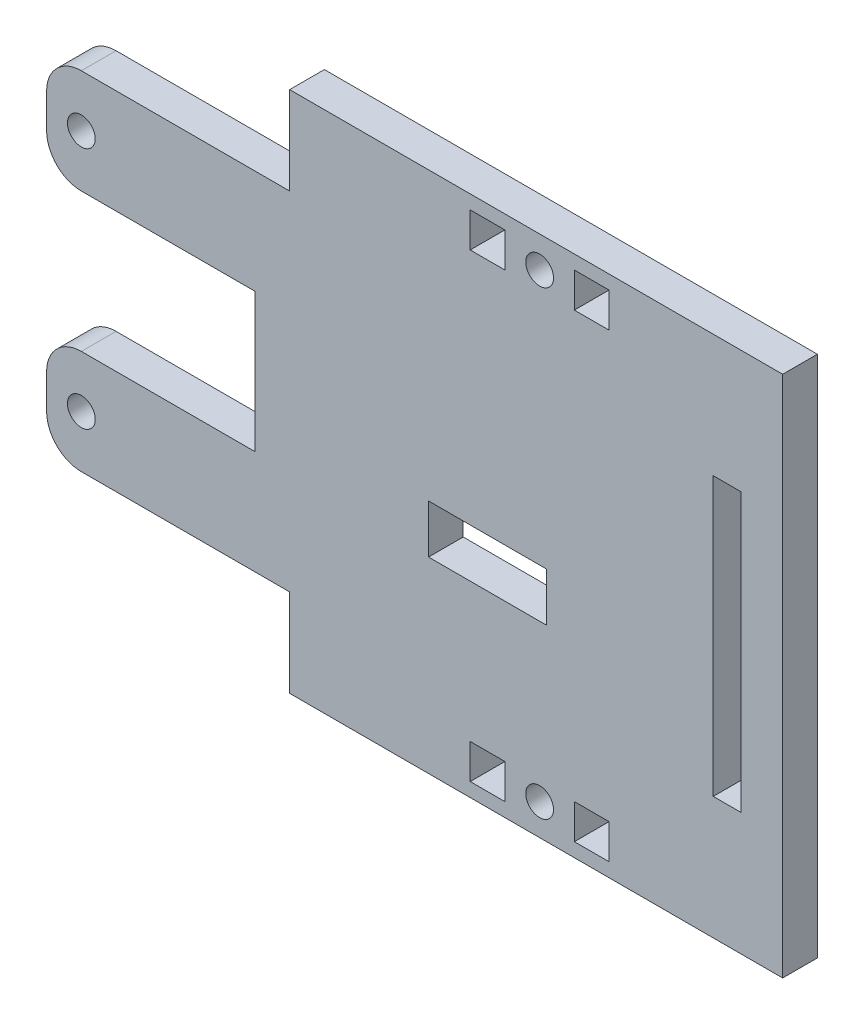
from build123d import *

# Parameters (mm, degrees)
ESQUISSE1_R        = 2
ESQUISSE1_W        = 17
ESQUISSE1_H        = 7
ESQUISSE1_W_2      = 4
ESQUISSE1_H_2      = 40
ESQUISSE1_W_3      = 5
ESQUISSE1_H_3      = 5
BOSS_EXTRU_1_DEPTH = 5
CONG_1_R           = 5


with BuildPart() as part:
    # Esquisse1 → Boss.-Extru.1 (new body)
    with BuildSketch(Plane.XY):
        Polygon((0, 37.65), (71, 37.65), (71, -37.65), (0, -37.65), (0, -25), (-35, -25), (-35, -10), (-5, -10), (-5, 10), (-35, 10), (-35, 25), (0, 25), align=None)
        with Locations((-30, 17.5)):
            Circle(ESQUISSE1_R, mode=Mode.SUBTRACT)
        with Locations(Location((-30, -17.5, 0), (0, 0, 180))):
            Circle(ESQUISSE1_R, mode=Mode.SUBTRACT)
        with Locations((36, 33.15)):
            Circle(ESQUISSE1_R, mode=Mode.SUBTRACT)
        with Locations(Location((36, -33.15, 0), (0, 0, 90))):
            Circle(ESQUISSE1_R, mode=Mode.SUBTRACT)
        with Locations((28.5, -7.15)):
            Rectangle(ESQUISSE1_W, ESQUISSE1_H, mode=Mode.SUBTRACT)
        with Locations((63, 0)):
            Rectangle(ESQUISSE1_W_2, ESQUISSE1_H_2, mode=Mode.SUBTRACT)
        with Locations((28.5, 33.15)):
            Rectangle(ESQUISSE1_W_3, ESQUISSE1_H_3, mode=Mode.SUBTRACT)
        with Locations((43.5, 33.15)):
            Rectangle(ESQUISSE1_W_3, ESQUISSE1_H_3, mode=Mode.SUBTRACT)
        with Locations((28.5, -33.15)):
            Rectangle(ESQUISSE1_W_3, ESQUISSE1_H_3, mode=Mode.SUBTRACT)
        with Locations((43.5, -33.15)):
            Rectangle(ESQUISSE1_W_3, ESQUISSE1_H_3, mode=Mode.SUBTRACT)
    extrude(amount=BOSS_EXTRU_1_DEPTH)

    # Congé1
    cong_1_edges = [part.edges().sort_by_distance(p)[0] for p in [
        (-35, -10, 2.5),
        (-35, 10, 2.5),
        (-35, 25, 2.5),
        (-35, -25, 2.5),
    ]]
    fillet(cong_1_edges, radius=CONG_1_R)


solid = part.part
